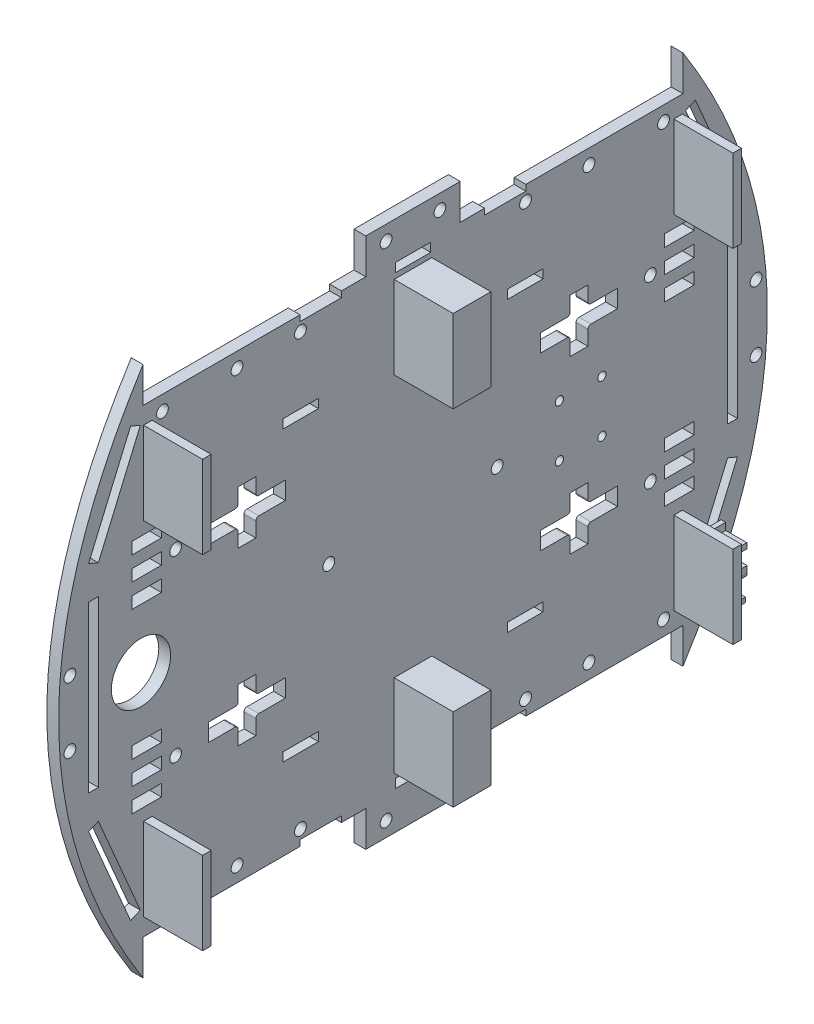
from build123d import *

# Parameters (mm, degrees)
BOSS_EXTRUDE1_DEPTH = 2
SKETCH3_W           = 1.455970522
SKETCH3_H           = 14
BOSS_EXTRUDE2_DEPTH = 10
SKETCH5_W           = 6.382449247
SKETCH5_H           = 14
BOSS_EXTRUDE3_DEPTH = 10
SKETCH6_R           = 5.019025209
CUT_EXTRUDE5_DEPTH  = 24
SKETCH7_W           = 1.653313371
SKETCH7_H           = 28
CUT_EXTRUDE6_DEPTH  = 41
SKETCH9_W           = 5
SKETCH9_H           = 2
SKETCH9_W_2         = 5.002240463
SKETCH9_W_3         = 5.002240462
CUT_EXTRUDE7_DEPTH  = 55
SKETCH10_R          = 1
SKETCH10_W          = 6
SKETCH10_H          = 1.5
CUT_EXTRUDE8_DEPTH  = 80
BOSS_EXTRUDE7_START = -2
SKETCH14_R          = 5.019025209
BOSS_EXTRUDE7_DEPTH = 2
SKETCH15_R          = 0.7
CUT_EXTRUDE10_DEPTH = 3
BOSS_EXTRUDE9_DEPTH = 3


with BuildPart() as part:
    # Sketch2 → Boss-Extrude1 (new body)
    with BuildSketch(Plane(origin=(0, 0, 0), x_dir=(0, 0, -1), z_dir=(1, 0, 0))):
        with BuildLine():
            Line((-14.245728155, 6), (-14.245728155, 0))
            add(Edge.make_bspline(
                [(0, 42.231757067), (-0.825561793, 21.115878533), (-14.245728155, 0)],
                knots=[0.530758255, 0.530758255, 0.530758255, 1, 1, 1], degree=2))
            Line((0, 42.231757067), (0, 47.768242933))
            add(Edge.make_bspline(
                [(-14.245728155, 90), (-0.825561793, 68.884121467), (0, 47.768242933)],
                knots=[0, 0, 0, 0.469241745, 0.469241745, 0.469241745], degree=2))
            Line((-14.245728155, 90), (-14.245728155, 84))
            Line((-14.245728155, 84), (-40.84468304, 84))
            Line((-40.84468304, 84), (-40.84468304, 83))
            Line((-40.84468304, 83), (-47.84468304, 83))
            Line((-47.84468304, 83), (-47.84468304, 84))
            Line((-47.84468304, 84), (-51.972942689, 84))
            Line((-51.972942689, 84), (-51.972942689, 90))
            Line((-51.972942689, 90), (-67.972942689, 90))
            Line((-67.972942689, 90), (-67.972942689, 84))
            Line((-67.972942689, 84), (-72.101202337, 84))
            Line((-72.101202337, 84), (-72.101202337, 83))
            Line((-72.101202337, 83), (-79.101202337, 83))
            Line((-79.101202337, 83), (-79.101202337, 84))
            Line((-79.101202337, 84), (-105.700157222, 84))
            Line((-105.700157222, 84), (-105.700157222, 90))
            add(Edge.make_bspline(
                [(-105.700157222, 90), (-120, 67.5), (-120, 45)],
                knots=[0, 0, 0, 0.5, 0.5, 0.5], degree=2))
            add(Edge.make_bspline(
                [(-120, 45), (-120, 22.5), (-105.700157222, 0)],
                knots=[0.5, 0.5, 0.5, 1, 1, 1], degree=2))
            Line((-105.700157222, 0), (-105.700157222, 6))
            Line((-105.700157222, 6), (-79.101202337, 6))
            Line((-79.101202337, 6), (-79.101202337, 7))
            Line((-79.101202337, 7), (-72.101202337, 7))
            Line((-72.101202337, 7), (-72.101202337, 6))
            Line((-72.101202337, 6), (-67.972942689, 6))
            Line((-67.972942689, 6), (-67.972942689, 0))
            Line((-67.972942689, 0), (-51.972942689, 0))
            Line((-51.972942689, 0), (-51.972942689, 6))
            Line((-51.972942689, 6), (-47.84468304, 6))
            Line((-47.84468304, 6), (-47.84468304, 7))
            Line((-47.84468304, 7), (-40.84468304, 7))
            Line((-40.84468304, 7), (-40.84468304, 6))
            Line((-40.84468304, 6), (-14.245728155, 6))
        make_face()
    extrude(amount=BOSS_EXTRUDE1_DEPTH)

    # Sketch3 → Boss-Extrude2 (add)
    with BuildSketch(Plane(origin=(2, 0, 0), x_dir=(0, 0, -1), z_dir=(1, 0, 0))):
        with Locations((-104.892152573, 74.057085822)):
            Rectangle(SKETCH3_W, SKETCH3_H)
        with Locations((-15.053732804, 74.057085822)):
            Rectangle(SKETCH3_W, SKETCH3_H)
        with Locations((-15.053732804, 15.942914178)):
            Rectangle(SKETCH3_W, SKETCH3_H)
        with Locations((-104.892152573, 15.942914178)):
            Rectangle(SKETCH3_W, SKETCH3_H)
    extrude(amount=BOSS_EXTRUDE2_DEPTH)

    # Sketch5 → Boss-Extrude3 (add)
    with BuildSketch(Plane(origin=(2, 0, 0), x_dir=(0, 0, -1), z_dir=(1, 0, 0))):
        with Locations((-59.972942689, 15.781743618)):
            Rectangle(SKETCH5_W, SKETCH5_H)
        with Locations((-59.972942689, 74.218256382)):
            Rectangle(SKETCH5_W, SKETCH5_H)
    extrude(amount=BOSS_EXTRUDE3_DEPTH)

    # Sketch6 → Cut-Extrude5 (cut)
    with BuildSketch(Plane(origin=(0, 0, 0), x_dir=(0, 0, -1), z_dir=(1, 0, 0))):
        with Locations((-106.054880611, 45)):
            Circle(SKETCH6_R)
        with Locations(Location((-13.891004766, 45, 0), (0, 0, 180))):
            Circle(SKETCH6_R)
        with BuildLine():
            Line((-86.601202337, 64), (-89.601202337, 64))
            Line((-89.601202337, 64), (-89.601202337, 61.5))
            ThreePointArc((-89.601202337, 61.5), (-89.747648947, 61.146446609), (-90.101202337, 61))
            Line((-90.101202337, 61), (-94.601202337, 61))
            Line((-94.601202337, 61), (-94.601202337, 58))
            Line((-94.601202337, 58), (-90.101202337, 58))
            ThreePointArc((-90.101202337, 58), (-89.747648947, 57.853553391), (-89.601202337, 57.5))
            Line((-89.601202337, 57.5), (-89.601202337, 55))
            Line((-89.601202337, 55), (-86.601202337, 55))
            Line((-86.601202337, 55), (-86.601202337, 57.5))
            ThreePointArc((-86.601202337, 57.5), (-86.454755728, 57.853553391), (-86.101202337, 58))
            Line((-86.101202337, 58), (-81.601202337, 58))
            Line((-81.601202337, 58), (-81.601202337, 61))
            Line((-81.601202337, 61), (-86.101202337, 61))
            ThreePointArc((-86.101202337, 61), (-86.454755728, 61.146446609), (-86.601202337, 61.5))
            Line((-86.601202337, 61.5), (-86.601202337, 64))
        make_face()
        with BuildLine():
            Line((-33.34468304, 57.5), (-33.34468304, 55))
            Line((-33.34468304, 55), (-30.34468304, 55))
            Line((-30.34468304, 55), (-30.34468304, 57.5))
            ThreePointArc((-30.34468304, 57.5), (-30.198236431, 57.853553391), (-29.84468304, 58))
            Line((-29.84468304, 58), (-25.34468304, 58))
            Line((-25.34468304, 58), (-25.34468304, 61))
            Line((-25.34468304, 61), (-29.84468304, 61))
            ThreePointArc((-29.84468304, 61), (-30.198236431, 61.146446609), (-30.34468304, 61.5))
            Line((-30.34468304, 61.5), (-30.34468304, 64))
            Line((-30.34468304, 64), (-33.34468304, 64))
            Line((-33.34468304, 64), (-33.34468304, 61.5))
            ThreePointArc((-33.34468304, 61.5), (-33.491129649, 61.146446609), (-33.84468304, 61))
            Line((-33.84468304, 61), (-38.34468304, 61))
            Line((-38.34468304, 61), (-38.34468304, 58))
            Line((-38.34468304, 58), (-33.84468304, 58))
            ThreePointArc((-33.84468304, 58), (-33.491129649, 57.853553391), (-33.34468304, 57.5))
        make_face()
        with BuildLine():
            Line((-86.601202337, 32.5), (-86.601202337, 35))
            Line((-86.601202337, 35), (-89.601202337, 35))
            Line((-89.601202337, 35), (-89.601202337, 32.5))
            ThreePointArc((-89.601202337, 32.5), (-89.747648947, 32.146446609), (-90.101202337, 32))
            Line((-90.101202337, 32), (-94.601202337, 32))
            Line((-94.601202337, 32), (-94.601202337, 29))
            Line((-94.601202337, 29), (-90.101202337, 29))
            ThreePointArc((-90.101202337, 29), (-89.747648947, 28.853553391), (-89.601202337, 28.5))
            Line((-89.601202337, 28.5), (-89.601202337, 26))
            Line((-89.601202337, 26), (-86.601202337, 26))
            Line((-86.601202337, 26), (-86.601202337, 28.5))
            ThreePointArc((-86.601202337, 28.5), (-86.454755728, 28.853553391), (-86.101202337, 29))
            Line((-86.101202337, 29), (-81.601202337, 29))
            Line((-81.601202337, 29), (-81.601202337, 32))
            Line((-81.601202337, 32), (-86.101202337, 32))
            ThreePointArc((-86.101202337, 32), (-86.454755728, 32.146446609), (-86.601202337, 32.5))
        make_face()
        with BuildLine():
            Line((-33.34468304, 26), (-30.34468304, 26))
            Line((-30.34468304, 26), (-30.34468304, 28.5))
            ThreePointArc((-30.34468304, 28.5), (-30.198236431, 28.853553391), (-29.84468304, 29))
            Line((-29.84468304, 29), (-25.34468304, 29))
            Line((-25.34468304, 29), (-25.34468304, 32))
            Line((-25.34468304, 32), (-29.84468304, 32))
            ThreePointArc((-29.84468304, 32), (-30.198236431, 32.146446609), (-30.34468304, 32.5))
            Line((-30.34468304, 32.5), (-30.34468304, 35))
            Line((-30.34468304, 35), (-33.34468304, 35))
            Line((-33.34468304, 35), (-33.34468304, 32.5))
            ThreePointArc((-33.34468304, 32.5), (-33.491129649, 32.146446609), (-33.84468304, 32))
            Line((-33.84468304, 32), (-38.34468304, 32))
            Line((-38.34468304, 32), (-38.34468304, 29))
            Line((-38.34468304, 29), (-33.84468304, 29))
            ThreePointArc((-33.84468304, 29), (-33.491129649, 28.853553391), (-33.34468304, 28.5))
            Line((-33.34468304, 28.5), (-33.34468304, 26))
        make_face()
    extrude(amount=CUT_EXTRUDE5_DEPTH, mode=Mode.SUBTRACT)

    # Sketch7 → Cut-Extrude6 (cut)
    with BuildSketch(Plane(origin=(0, 0, 0), x_dir=(0, 0, -1), z_dir=(1, 0, 0))):
        Polygon((-107.814367749, 82.013325998), (-114.927248901, 65.416603309), (-113.27393553, 64.708040435), (-106.161054377, 81.304763125), align=None)
        with Locations((-114.100592216, 45.752642391)):
            Rectangle(SKETCH7_W, SKETCH7_H)
        Polygon((-107.814367749, 9.491958783), (-114.927248901, 26.088681473), (-113.27393553, 26.797244346), (-106.161054377, 10.200521657), align=None)
        Polygon((-6.671949847, 26.797244346), (-13.784831, 10.200521657), (-12.131517629, 9.491958783), (-5.018636476, 26.088681473), align=None)
        with Locations((-5.845293162, 45.752642391)):
            Rectangle(SKETCH7_W, SKETCH7_H)
        Polygon((-12.131517629, 82.013325998), (-5.018636476, 65.416603309), (-6.671949847, 64.708040435), (-13.784831, 81.304763125), align=None)
    extrude(amount=CUT_EXTRUDE6_DEPTH, mode=Mode.SUBTRACT)

    # Sketch9 → Cut-Extrude7 (cut)
    with BuildSketch(Plane(origin=(0, 0, 0), x_dir=(0, 0, -1), z_dir=(1, 0, 0))):
        with Locations((-14.857460488, 56)):
            Rectangle(SKETCH9_W, SKETCH9_H)
        with Locations((-14.856340257, 60)):
            Rectangle(SKETCH9_W_2, SKETCH9_H)
        with Locations((-14.856340257, 64)):
            Rectangle(SKETCH9_W_2, SKETCH9_H)
        with Locations((-14.856340257, 26)):
            Rectangle(SKETCH9_W_2, SKETCH9_H)
        with Locations((-14.856340257, 30)):
            Rectangle(SKETCH9_W_2, SKETCH9_H)
        with Locations((-14.857460488, 34)):
            Rectangle(SKETCH9_W, SKETCH9_H)
        with Locations((-105.08842489, 34)):
            Rectangle(SKETCH9_W, SKETCH9_H)
        with Locations((-105.089545121, 30)):
            Rectangle(SKETCH9_W_3, SKETCH9_H)
        with Locations((-105.089545121, 26)):
            Rectangle(SKETCH9_W_3, SKETCH9_H)
        with Locations((-105.089545121, 64)):
            Rectangle(SKETCH9_W_3, SKETCH9_H)
        with Locations((-105.089545121, 60)):
            Rectangle(SKETCH9_W_3, SKETCH9_H)
        with Locations((-105.08842489, 56)):
            Rectangle(SKETCH9_W, SKETCH9_H)
    extrude(amount=CUT_EXTRUDE7_DEPTH, mode=Mode.SUBTRACT)

    # Sketch10 → Cut-Extrude8 (cut)
    with BuildSketch(Plane(origin=(0, 0, 0), x_dir=(0, 0, -1), z_dir=(1, 0, 0))):
        with Locations((-102.413846874, 81.486445913)):
            Circle(SKETCH10_R)
        with Locations((-100.174606511, 60.147802455)):
            Circle(SKETCH10_R)
        with Locations((-74.225762305, 45)):
            Circle(SKETCH10_R)
        with Locations((-118.088529414, 50.532240897)):
            Circle(SKETCH10_R)
        with Locations(Location((-1.857355964, 50.532240897, 0), (0, 0, 180))):
            Circle(SKETCH10_R)
        with Locations(Location((-19.771278867, 60.147802455, 0), (0, 0, 180))):
            Circle(SKETCH10_R)
        with Locations(Location((-17.532038504, 81.486445913, 0), (0, 0, 180))):
            Circle(SKETCH10_R)
        with Locations(Location((-118.088529414, 39.467759103, 0), (0, 0, 180))):
            Circle(SKETCH10_R)
        with Locations(Location((-102.413846874, 8.513554087, 0), (0, 0, 180))):
            Circle(SKETCH10_R)
        with Locations(Location((-100.174606511, 29.852197545, 0), (0, 0, 180))):
            Circle(SKETCH10_R)
        with Locations((-1.857355964, 39.467759103)):
            Circle(SKETCH10_R)
        with Locations((-19.771278867, 29.852197545)):
            Circle(SKETCH10_R)
        with Locations((-17.532038504, 8.513554087)):
            Circle(SKETCH10_R)
        with Locations(Location((-45.720123072, 45, 0), (0, 0, 180))):
            Circle(SKETCH10_R)
        with Locations((-64.529996105, 87.500310769)):
            Circle(SKETCH10_R)
        with Locations((-30.168054073, 81.486445913)):
            Circle(SKETCH10_R)
        with Locations(Location((-64.529996105, 2.499689231, 0), (0, 0, 180))):
            Circle(SKETCH10_R)
        with Locations((-40.906767839, 81.486445913)):
            Circle(SKETCH10_R)
        with Locations((-55.415889272, 2.499689231)):
            Circle(SKETCH10_R)
        with Locations(Location((-55.415889272, 87.500310769, 0), (0, 0, 180))):
            Circle(SKETCH10_R)
        with Locations(Location((-79.039117538, 81.486445913, 0), (0, 0, 180))):
            Circle(SKETCH10_R)
        with Locations(Location((-89.777831304, 81.486445913, 0), (0, 0, 180))):
            Circle(SKETCH10_R)
        with Locations((-89.777831304, 8.513554087)):
            Circle(SKETCH10_R)
        with Locations((-79.039117538, 8.513554087)):
            Circle(SKETCH10_R)
        with Locations(Location((-30.168054073, 8.513554087, 0), (0, 0, 180))):
            Circle(SKETCH10_R)
        with Locations(Location((-40.906767839, 8.513554087, 0), (0, 0, 180))):
            Circle(SKETCH10_R)
        with Locations((-59.972942689, 82.838520173)):
            Rectangle(SKETCH10_W, SKETCH10_H)
        with Locations((-40.952074728, 69.432544348)):
            Rectangle(SKETCH10_W, SKETCH10_H)
        with Locations((-78.993810649, 69.432544348)):
            Rectangle(SKETCH10_W, SKETCH10_H)
        with Locations((-78.993810649, 20.567455652)):
            Rectangle(SKETCH10_W, SKETCH10_H)
        with Locations((-59.972942689, 7.161479827)):
            Rectangle(SKETCH10_W, SKETCH10_H)
        with Locations((-40.952074728, 20.567455652)):
            Rectangle(SKETCH10_W, SKETCH10_H)
    extrude(amount=CUT_EXTRUDE8_DEPTH, mode=Mode.SUBTRACT)

    # Sketch14 → Boss-Extrude7 (add)
    with BuildSketch(Plane(origin=(2, 0, 0), x_dir=(0, 0, -1), z_dir=(1, 0, 0)).offset(BOSS_EXTRUDE7_START)):
        with Locations((-13.891004766, 45)):
            Circle(SKETCH14_R)
    extrude(amount=BOSS_EXTRUDE7_DEPTH)

    # Sketch15 → Cut-Extrude10 (cut)
    with BuildSketch(Plane.ZY):
        with Locations((27.972277175, 49.4)):
            Circle(SKETCH15_R)
        with Locations((35.172277175, 49.4)):
            Circle(SKETCH15_R)
        with Locations((27.972277175, 40.6)):
            Circle(SKETCH15_R)
        with Locations((35.172277175, 40.6)):
            Circle(SKETCH15_R)
    extrude(amount=-CUT_EXTRUDE10_DEPTH, mode=Mode.SUBTRACT)

    # Sketch16 → Boss-Extrude9 (add)
    # profile 1 of 3: a face of its own
    with BuildSketch(Plane(origin=(0, 0, 14.325747543), x_dir=(-1, 0, 0), z_dir=(0, 0, -1))):
        Polygon((-9.900152095, 19.700905328), (-6.323897045, 19.700905328), (-6.323897045, 18.222261413), (-5.564166556, 18.222261413), (-5.564166556, 21.832903531), (-6.323897045, 21.832903531), (-6.323897045, 20.629356158), (-9.900152095, 20.629356158), align=None)
    # profile 2 of 3: a face of its own
    with BuildSketch(Plane(origin=(0, 0, 14.325747543), x_dir=(-1, 0, 0), z_dir=(0, 0, -1))):
        with BuildLine():
            Line((-9.949924556, 17.302077077), (-5.957515551, 17.302077077))
            Line((-5.957515551, 17.302077077), (-5.957515551, 16.086500775))
            ThreePointArc((-5.957515551, 16.086500775), (-6.905115403, 15.187760404), (-7.75248056, 16.181567238))
            Line((-7.75248056, 16.181567238), (-7.944948717, 16.181567238))
            ThreePointArc((-7.944948717, 16.181567238), (-8.975531465, 15.236496177), (-9.949924556, 16.239401066))
            Line((-9.949924556, 16.239401066), (-9.949924556, 17.302077077))
        make_face()
        with BuildLine():
            Line((-9.239093138, 16.691980519), (-8.478310425, 16.691980519))
            Line((-8.478310425, 16.691980519), (-8.478310425, 16.239401066))
            ThreePointArc((-8.478310425, 16.239401066), (-8.858701781, 15.85900971), (-9.239093138, 16.239401066))
            Line((-9.239093138, 16.239401066), (-9.239093138, 16.691980519))
        make_face(mode=Mode.SUBTRACT)
        with BuildLine():
            Line((-7.050851693, 16.691980519), (-6.335883143, 16.691980519))
            Line((-6.335883143, 16.691980519), (-6.335883143, 16.34358896))
            ThreePointArc((-6.335883143, 16.34358896), (-6.693367418, 15.986104685), (-7.050851693, 16.34358896))
            Line((-7.050851693, 16.34358896), (-7.050851693, 16.691980519))
        make_face(mode=Mode.SUBTRACT)
    # profile 3 of 3: a face of its own
    with BuildSketch(Plane(origin=(0, 0, 14.325747543), x_dir=(-1, 0, 0), z_dir=(0, 0, -1))):
        Polygon((-5.564166556, 13.970818335), (-5.564166556, 10.668186234), (-6.335883143, 10.668186234), (-6.335883143, 11.729495332), (-9.681103629, 11.729495332), (-9.681103629, 12.532328835), (-6.335883143, 12.532328835), (-6.335883143, 13.970818335), align=None)
    extrude(amount=BOSS_EXTRUDE9_DEPTH)


solid = part.part
